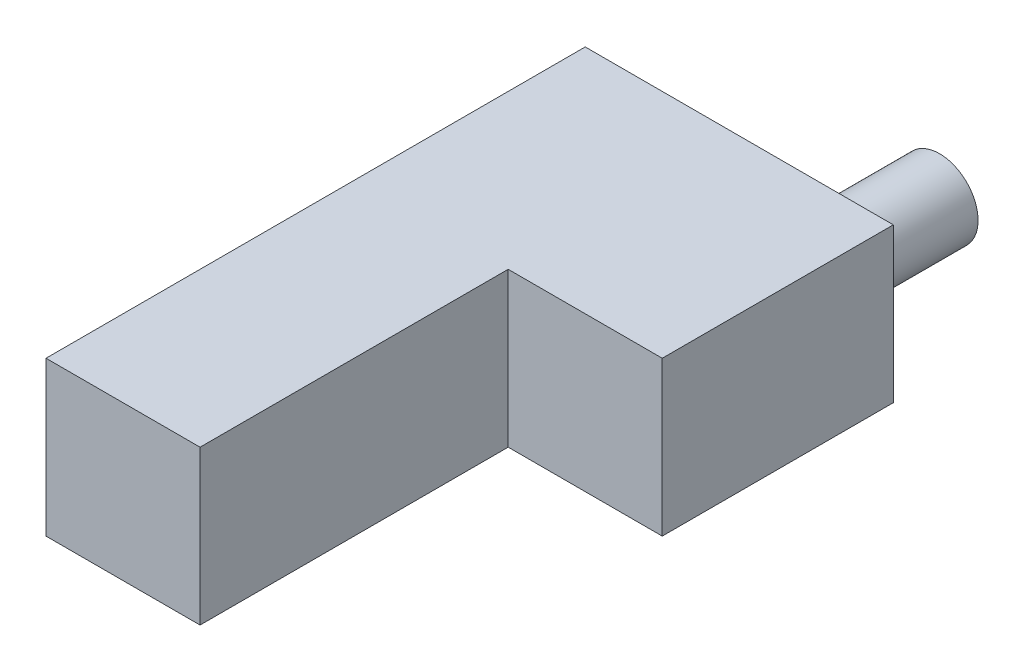
from build123d import *

# Parameters (mm, degrees)
BOSS_EXTRUDE1_DEPTH = 10
SKETCH2_R           = 2.5
BOSS_EXTRUDE2_DEPTH = 8


with BuildPart() as part:
    # Sketch1 → Boss-Extrude1 (new body)
    with BuildSketch(Plane(origin=(0, 0, 0), x_dir=(1, 0, 0), z_dir=(0, 1, 0))):
        Polygon((-5, -17.5), (5, -17.5), (5, 2.5), (15, 2.5), (15, 17.5), (5, 17.5), (-5, 17.5), align=None)
    extrude(amount=BOSS_EXTRUDE1_DEPTH)

    # Sketch2 → Boss-Extrude2 (add)
    with BuildSketch(Plane(origin=(0, 0, -17.5), x_dir=(-1, 0, 0), z_dir=(0, 0, -1))):
        with Locations((-10, 5)):
            Circle(SKETCH2_R)
    extrude(amount=BOSS_EXTRUDE2_DEPTH)


solid = part.part
